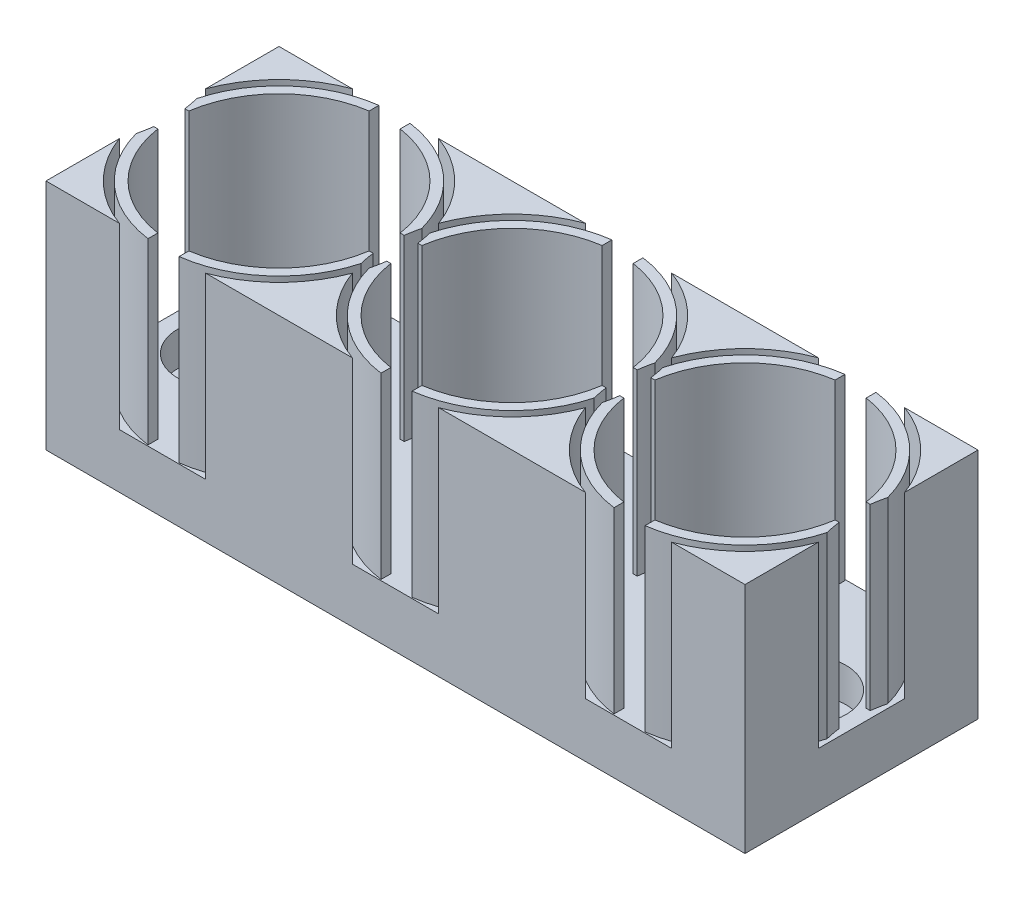
from build123d import *

# Parameters (mm, degrees)
SKETCH2_W                                           = 150
SKETCH2_H                                           = 30
BOSS_EXTRUDE1_DEPTH                                 = 30
SKETCH3_R                                           = 13.75
CUT_EXTRUDE1_DEPTH                                  = 23
LPATTERN1_COUNT                                     = 5
LPATTERN1_PITCH                                     = 30
CBORE_FOR_M4_HEX_SOCKET_HEAD_CAP_SCREW1_D           = 4.5
CBORE_FOR_M4_HEX_SOCKET_HEAD_CAP_SCREW1_CBORE_D     = 8
CBORE_FOR_M4_HEX_SOCKET_HEAD_CAP_SCREW1_CBORE_DEPTH = 4.4
LPATTERN2_COUNT                                     = 2
LPATTERN2_PITCH                                     = 120
SKETCH7_W                                           = 181.12901383
SKETCH7_H                                           = 4
CUT_EXTRUDE3_DEPTH                                  = 23
SKETCH8_W                                           = 4
SKETCH8_H                                           = 50
CUT_EXTRUDE4_DEPTH                                  = 23
SKIZZE1_R                                           = 16
SKIZZE1_R_2                                         = 15
SCHNITT_LINEAR_AUSTRAGEN1_DEPTH                     = 80.868642157
LPATTERN3_COUNT                                     = 5
LPATTERN3_PITCH                                     = 30
CBORE_FOR_M6_HEX_SOCKET_HEAD_CAP_SCREW1_D           = 6.6
CBORE_FOR_M6_HEX_SOCKET_HEAD_CAP_SCREW1_CBORE_D     = 11
CBORE_FOR_M6_HEX_SOCKET_HEAD_CAP_SCREW1_CBORE_DEPTH = 4.4
LPATTERN4_COUNT                                     = 2
LPATTERN4_PITCH                                     = 75
SKIZZE2_W                                           = 30
SKIZZE2_H                                           = 30
SCHNITT_LINEAR_AUSTRAGEN2_DEPTH                     = 30
SKIZZE3_W                                           = 30
SKIZZE3_H                                           = 30
SCHNITT_LINEAR_AUSTRAGEN3_DEPTH                     = 30


with BuildPart() as part:
    # Sketch2 → Boss-Extrude1 (new body)
    with BuildSketch(Plane(origin=(0, 0, 0), x_dir=(1, 0, 0), z_dir=(0, 1, 0))):
        Rectangle(SKETCH2_W, SKETCH2_H)
    extrude(amount=BOSS_EXTRUDE1_DEPTH)

    # Sketch3 → Cut-Extrude1 (cut)
    with BuildSketch(Plane(origin=(0, 30, 0), x_dir=(1, 0, 0), z_dir=(0, 1, 0))):
        with Locations(Location((-60, 0, 0), (0, 0, 270))):
            Circle(SKETCH3_R)
    cut_extrude1 = extrude(amount=-CUT_EXTRUDE1_DEPTH, mode=Mode.SUBTRACT)

    # LPattern1: Cut-Extrude1 ×5
    with Locations(*[(i * LPATTERN1_PITCH, 0, 0) for i in range(1, LPATTERN1_COUNT)]):
        add(cut_extrude1, mode=Mode.SUBTRACT)

    # CBORE for M4 Hex Socket Head Cap Screw1 (through all)
    with Locations(Plane(origin=(0, 7, 0), x_dir=(-1, 0, 0), z_dir=(0, 1, 0))):
        with Locations((60, 0)):
            cbore_for_m4_hex_socket_head_cap_screw1 = CounterBoreHole(CBORE_FOR_M4_HEX_SOCKET_HEAD_CAP_SCREW1_D / 2, CBORE_FOR_M4_HEX_SOCKET_HEAD_CAP_SCREW1_CBORE_D / 2, CBORE_FOR_M4_HEX_SOCKET_HEAD_CAP_SCREW1_CBORE_DEPTH)

    # LPattern2: CBORE for M4 Hex Socket Head Cap Screw1 ×2
    with Locations(*[(i * LPATTERN2_PITCH, 0, 0) for i in range(1, LPATTERN2_COUNT)]):
        add(cbore_for_m4_hex_socket_head_cap_screw1, mode=Mode.SUBTRACT)

    # Sketch7 → Cut-Extrude3 (cut)
    with BuildSketch(Plane(origin=(0, 30, 0), x_dir=(1, 0, 0), z_dir=(0, 1, 0))):
        Rectangle(SKETCH7_W, SKETCH7_H)
    extrude(amount=-CUT_EXTRUDE3_DEPTH, mode=Mode.SUBTRACT)

    # Sketch8 → Cut-Extrude4 (cut)
    with BuildSketch(Plane(origin=(0, 30, 0), x_dir=(-1, 0, 0), z_dir=(0, 1, 0))):
        with Locations((60, -1.298701607)):
            Rectangle(SKETCH8_W, SKETCH8_H)
    cut_extrude4 = extrude(amount=-CUT_EXTRUDE4_DEPTH, mode=Mode.SUBTRACT)

    # Skizze1 → Schnitt-Linear austragen1 (cut, through all)
    with BuildSketch(Plane(origin=(0, 7, 0), x_dir=(-1, 0, 0), z_dir=(0, 1, 0))):
        with Locations((60, 0)):
            Circle(SKIZZE1_R)
        with Locations((60, 0)):
            Circle(SKIZZE1_R_2, mode=Mode.SUBTRACT)
    schnitt_linear_austragen1 = extrude(amount=SCHNITT_LINEAR_AUSTRAGEN1_DEPTH, mode=Mode.SUBTRACT)

    # LPattern3: Cut-Extrude4, Schnitt-Linear austragen1 ×5
    with Locations(*[(i * LPATTERN3_PITCH, 0, 0) for i in range(1, LPATTERN3_COUNT)]):
        add(cut_extrude4, mode=Mode.SUBTRACT)
        add(schnitt_linear_austragen1, mode=Mode.SUBTRACT)

    # CBORE for M6 Hex Socket Head Cap Screw1 (through all)
    with Locations(Plane(origin=(0, 7, 0), x_dir=(-1, 0, 0), z_dir=(0, 1, 0))):
        with Locations((37.5, 0)):
            cbore_for_m6_hex_socket_head_cap_screw1 = CounterBoreHole(CBORE_FOR_M6_HEX_SOCKET_HEAD_CAP_SCREW1_D / 2, CBORE_FOR_M6_HEX_SOCKET_HEAD_CAP_SCREW1_CBORE_D / 2, CBORE_FOR_M6_HEX_SOCKET_HEAD_CAP_SCREW1_CBORE_DEPTH)

    # LPattern4: CBORE for M6 Hex Socket Head Cap Screw1 ×2
    with Locations(*[(i * LPATTERN4_PITCH, 0, 0) for i in range(1, LPATTERN4_COUNT)]):
        add(cbore_for_m6_hex_socket_head_cap_screw1, mode=Mode.SUBTRACT)

    # Skizze2 → Schnitt-Linear austragen2 (cut)
    with BuildSketch(Plane.ZY.offset(75)):
        with Locations((0, 15)):
            Rectangle(SKIZZE2_W, SKIZZE2_H)
    extrude(amount=-SCHNITT_LINEAR_AUSTRAGEN2_DEPTH, mode=Mode.SUBTRACT)

    # Skizze3 → Schnitt-Linear austragen3 (cut)
    with BuildSketch(Plane(origin=(75, 0, 0), x_dir=(0, 0, -1), z_dir=(1, 0, 0))):
        with Locations((0, 15)):
            Rectangle(SKIZZE3_W, SKIZZE3_H)
    extrude(amount=-SCHNITT_LINEAR_AUSTRAGEN3_DEPTH, mode=Mode.SUBTRACT)


solid = part.part
